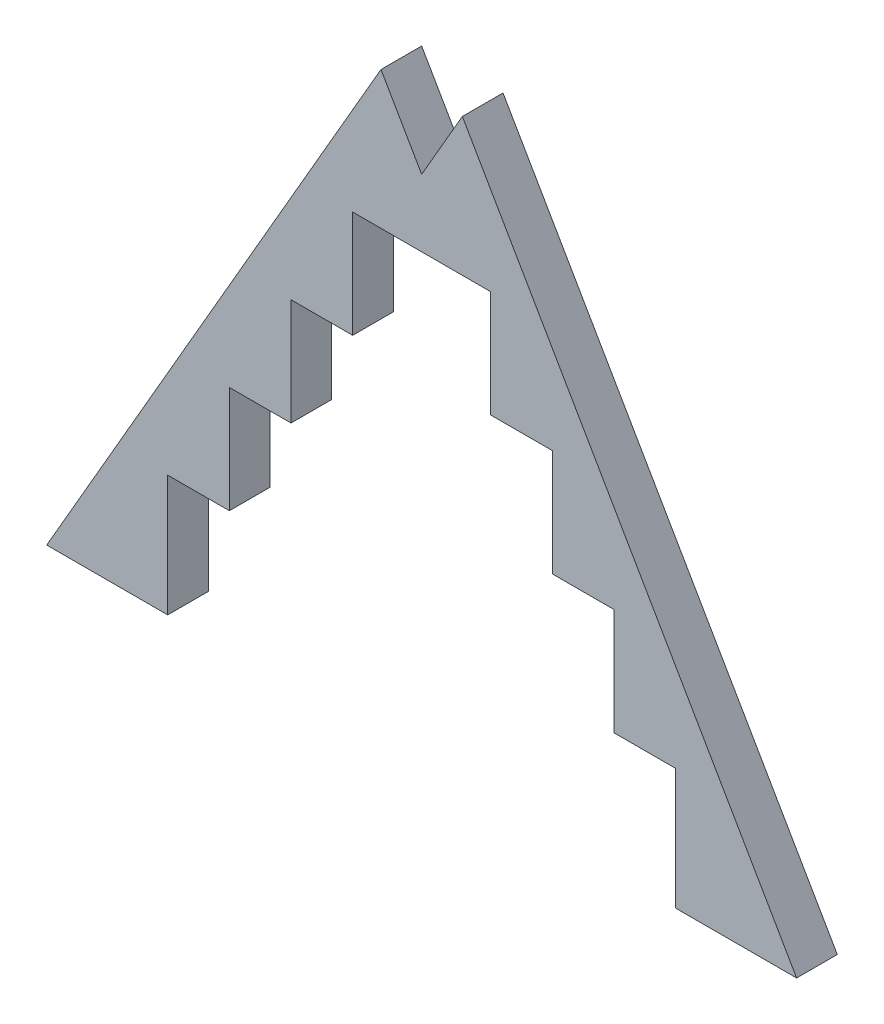
from build123d import *

# Parameters (mm, degrees)
EXTRUDE_1_DEPTH = 2


with BuildPart() as part:
    # 草图1 → 凸台-拉伸1 (new body)
    with BuildSketch(Plane.XY):
        Polygon((-12.485, 5.95), (-12.485, 0), (-18.43375673, 0), (-2, 28.464101615), (0, 25), (2, 28.464101615), (18.43375673, 0), (12.485, 0), (12.485, 5.95), (9.453911087, 5.95), (9.453911087, 11.2), (6.422822174, 11.2), (6.422822174, 16.45), (3.39173326, 16.45), (3.39173326, 21.7), (-3.39173326, 21.7), (-3.39173326, 16.45), (-6.422822174, 16.45), (-6.422822174, 11.2), (-9.453911087, 11.2), (-9.453911087, 5.95), align=None)
    extrude(amount=EXTRUDE_1_DEPTH)


solid = part.part
